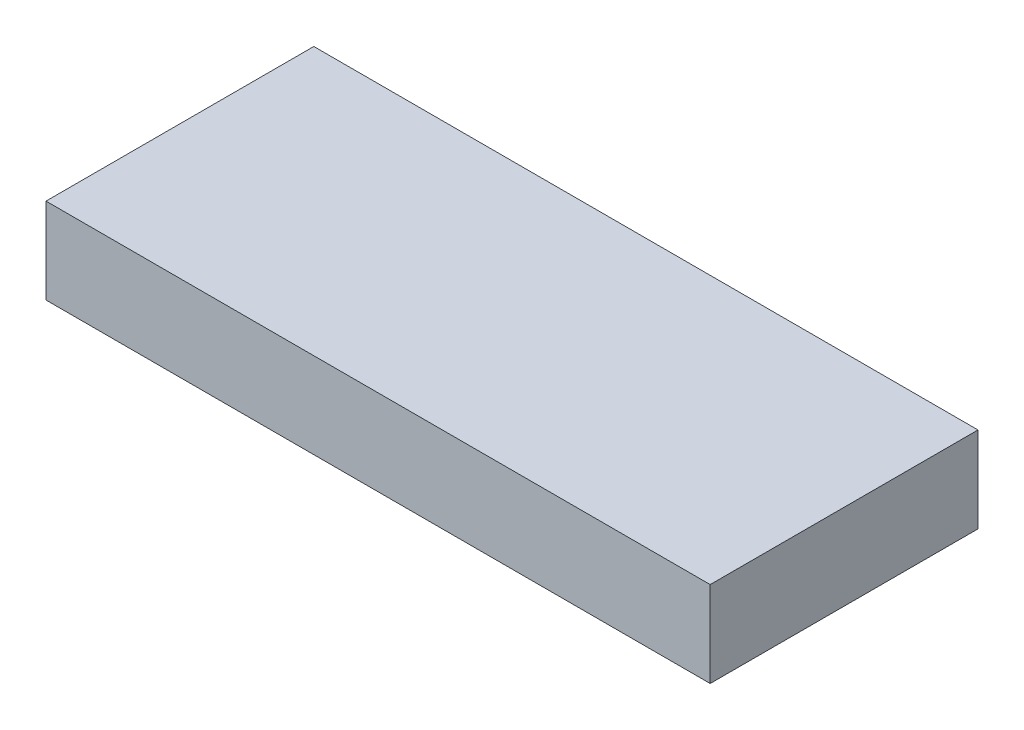
from build123d import *

# Parameters (mm, degrees)
SKETCH1_W           = 93
SKETCH1_H           = 37.5
BOSS_EXTRUDE1_DEPTH = 12


with BuildPart() as part:
    # Sketch1 → Boss-Extrude1 (new body)
    with BuildSketch(Plane(origin=(0, 0, 0), x_dir=(1, 0, 0), z_dir=(0, 1, 0))):
        Rectangle(SKETCH1_W, SKETCH1_H)
    extrude(amount=BOSS_EXTRUDE1_DEPTH)


solid = part.part
